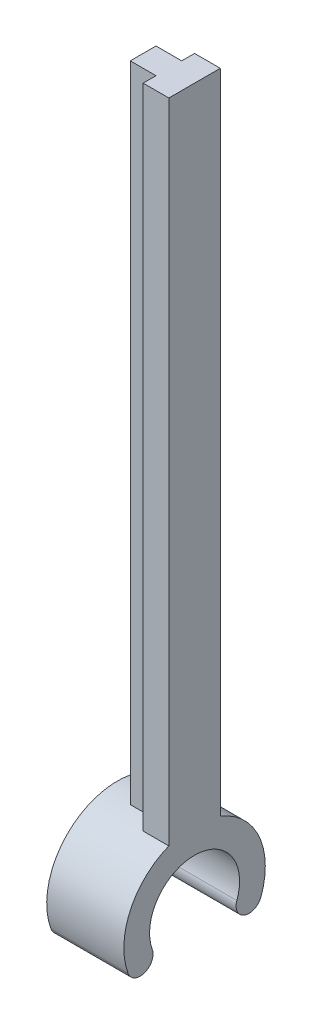
from build123d import *

# Parameters (mm, degrees)
BOSS_EXTRUDE1_DEPTH      = 2
BOSS_EXTRUDE1_DEPTH_BACK = 4
BOSS_EXTRUDE2_DEPTH      = 2
BOSS_EXTRUDE3_DEPTH      = 2


with BuildPart() as part:
    # Sketch1 → Boss-Extrude1 (new, two sides: drawn at the far end of the back side and taken through both)
    with BuildSketch(Plane(origin=(0, 0, 0), x_dir=(0, 0, -1), z_dir=(1, 0, 0)).offset(-BOSS_EXTRUDE1_DEPTH_BACK)):
        with BuildLine():
            Line((-5.5, 0), (-3.5, 0))
            ThreePointArc((-3.5, 0), (0, 3.5), (3.5, 0))
            ThreePointArc((3.5, 0), (3.446827136, -0.607768622), (3.288924173, -1.197070502))
            Line((3.288924173, -1.197070502), (5.168309414, -1.881110788))
            ThreePointArc((5.168309414, -1.881110788), (5.416442642, -0.955064977), (5.5, 0))
            ThreePointArc((5.5, 0), (0, 5.5), (-5.5, 0))
        make_face()
        with BuildLine():
            Line((5.168309414, -1.881110788), (3.288924173, -1.197070502))
            ThreePointArc((3.288924173, -1.197070502), (3.88659665, -2.478783266), (5.168309414, -1.881110788))
        make_face()
        with BuildLine():
            ThreePointArc((-3.288924173, -1.197070502), (-3.446827136, -0.607768622), (-3.5, 0))
            Line((-3.5, 0), (-5.5, 0))
            ThreePointArc((-5.5, 0), (-5.416442642, -0.955064977), (-5.168309414, -1.881110788))
            Line((-5.168309414, -1.881110788), (-4.228616794, -1.539090645))
            Line((-4.228616794, -1.539090645), (-3.288924173, -1.197070502))
        make_face()
        with BuildLine():
            ThreePointArc((-5.168309414, -1.881110788), (-3.88659665, -2.478783266), (-3.288924173, -1.197070502))
            Line((-3.288924173, -1.197070502), (-4.228616794, -1.539090645))
            Line((-4.228616794, -1.539090645), (-5.168309414, -1.881110788))
        make_face()
    extrude(amount=BOSS_EXTRUDE1_DEPTH + BOSS_EXTRUDE1_DEPTH_BACK)

    # Sketch2 → Boss-Extrude2 (add)
    with BuildSketch(Plane(origin=(0, 0, 0), x_dir=(0, 0, -1), z_dir=(1, 0, 0))):
        Polygon((-2, 3.5), (0, 3.5), (2, 3.5), (2, 55.5), (-2, 55.5), align=None)
    extrude(amount=BOSS_EXTRUDE2_DEPTH)

    # Sketch3 → Boss-Extrude3 (add)
    with BuildSketch(Plane(origin=(0, 0, 0), x_dir=(0, 0, -1), z_dir=(1, 0, 0))):
        Polygon((1, 55.5), (0, 55.5), (-1, 55.5), (-1, 3.5), (1, 3.5), align=None)
    extrude(amount=-BOSS_EXTRUDE3_DEPTH)


solid = part.part
